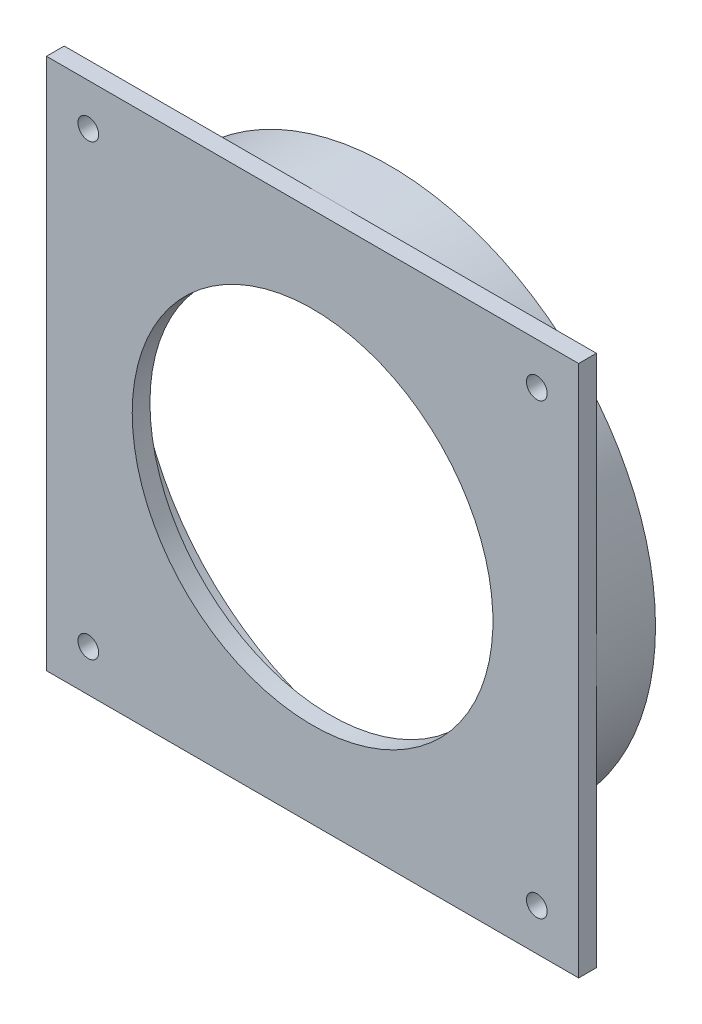
from build123d import *

# Parameters (mm, degrees)
SKETCH1_W           = 90
SKETCH1_H           = 90
BOSS_EXTRUDE1_DEPTH = 3
SKETCH9_R           = 45
SKETCH9_R_2         = 43
BOSS_EXTRUDE4_DEPTH = 10
SKETCH11_R          = 30.5
CUT_EXTRUDE9_DEPTH  = 58
SKETCH14_R          = 1.75
CUT_EXTRUDE10_DEPTH = 58


with BuildPart() as part:
    # Sketch1 → Boss-Extrude1 (new body)
    with BuildSketch(Plane.XY):
        Rectangle(SKETCH1_W, SKETCH1_H)
    extrude(amount=BOSS_EXTRUDE1_DEPTH)

    # Sketch9 → Boss-Extrude4 (add)
    with BuildSketch(Plane(origin=(0, 0, 0), x_dir=(-1, 0, 0), z_dir=(0, 0, -1))):
        Circle(SKETCH9_R)
        Circle(SKETCH9_R_2, mode=Mode.SUBTRACT)
    extrude(amount=BOSS_EXTRUDE4_DEPTH)

    # Sketch11 → Cut-Extrude9 (cut)
    with BuildSketch(Plane(origin=(0, 0, 0), x_dir=(-1, 0, 0), z_dir=(0, 0, -1))):
        Circle(SKETCH11_R)
    extrude(amount=-CUT_EXTRUDE9_DEPTH, mode=Mode.SUBTRACT)

    # Sketch14 → Cut-Extrude10 (cut)
    with BuildSketch(Plane.XY.offset(3)):
        with Locations((-37.928932188, 37.928932188)):
            Circle(SKETCH14_R)
        with Locations((37.928932188, 37.928932188)):
            Circle(SKETCH14_R)
        with Locations((37.928932188, -37.928932188)):
            Circle(SKETCH14_R)
        with Locations((-37.928932188, -37.928932188)):
            Circle(SKETCH14_R)
    extrude(amount=-CUT_EXTRUDE10_DEPTH, mode=Mode.SUBTRACT)


solid = part.part
